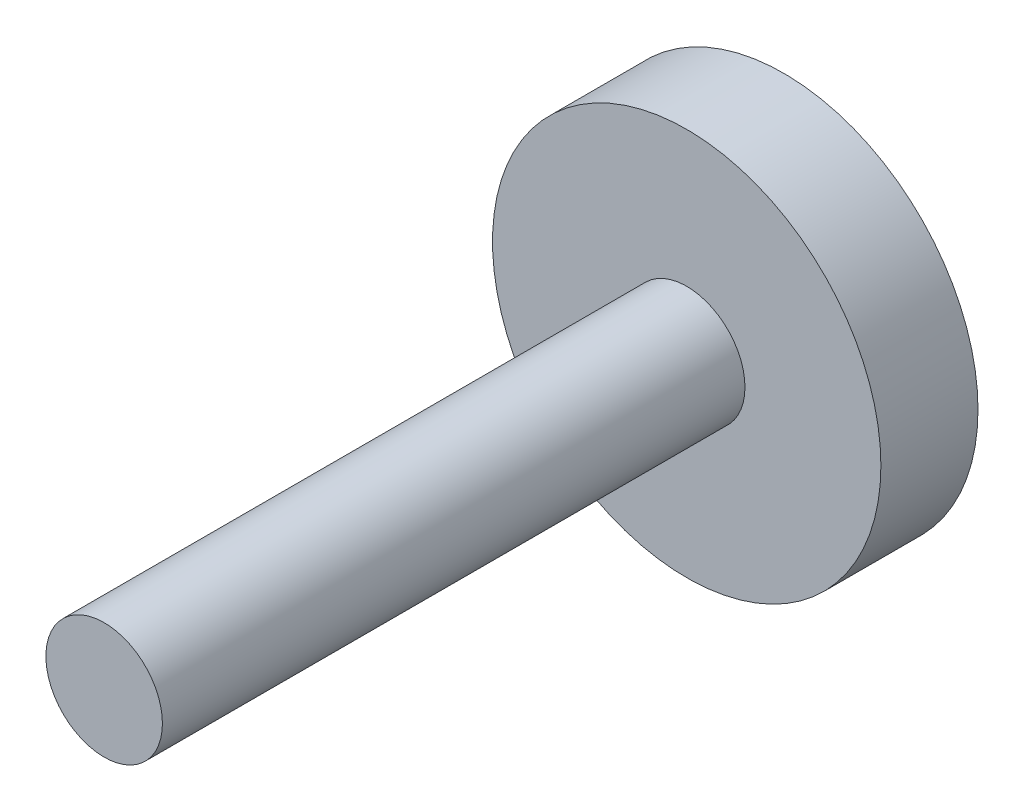
from build123d import *

# Parameters (mm, degrees)
SKETCH1_R           = 5
BOSS_EXTRUDE1_DEPTH = 1.25
SKETCH2_R           = 1.5
BOSS_EXTRUDE2_DEPTH = 15
BOSS_EXTRUDE3_DEPTH = 1


with BuildPart() as part:
    # Sketch1 → Boss-Extrude1 (new, symmetric)
    with BuildSketch(Plane.XY):
        Circle(SKETCH1_R)
    extrude(amount=BOSS_EXTRUDE1_DEPTH, both=True)

    # Sketch2 → Boss-Extrude2 (add)
    with BuildSketch(Plane.XY.offset(1.25)):
        Circle(SKETCH2_R)
    extrude(amount=BOSS_EXTRUDE2_DEPTH)

    # Sketch3 → Boss-Extrude3 (add)
    # profile 1 of 2: a face of its own
    with BuildSketch(Plane(origin=(0, 0, -1.25), x_dir=(-1, 0, 0), z_dir=(0, 0, -1))):
        Polygon((-1.479879797, 1.389092813), (-0.89930688, 1.389092813), (-0.89930688, -1.750907187), (-1.181101752, -1.750907187), (-1.181101752, 1.067041531), (-1.664178675, 1.067041531), align=None)
    # profile 2 of 2: a face of its own
    with BuildSketch(Plane(origin=(0, 0, -1.25), x_dir=(-1, 0, 0), z_dir=(0, 0, -1))):
        with BuildLine():
            Line((1.717359786, 1.469605634), (1.934366998, 1.299144896))
            Line((1.934366998, 1.299144896), (1.104707543, 0.030438967))
            add(Edge.make_bspline(
                [(1.104707543, 0.030438967), (1.159944877, 0.039243402), (1.267691543, 0.056417448), (1.37675352, 0.059250576), (1.429903857, 0.060631275)],
                knots=[0, 0, 0, 0, 1.025318673, 2, 2, 2, 2], degree=3))
            add(Edge.make_bspline(
                [(1.429903857, 0.060631275), (1.461817468, 0.059773506), (1.524638462, 0.058085014), (1.61687085, 0.04509093), (1.705498638, 0.024613544), (1.790154484, -0.005236423), (1.871142245, -0.043367106), (1.948926681, -0.08906655), (2.022045627, -0.144694503), (2.091440685, -0.206835063), (2.154444424, -0.275661158), (2.210225228, -0.348689786), (2.257080121, -0.425844862), (2.295095582, -0.507087307), (2.324615959, -0.592291889), (2.346136303, -0.681349591), (2.358857424, -0.774321825), (2.360584864, -0.837550817), (2.361462351, -0.869669206)],
                knots=[0, 0, 0, 0, 1.04369286, 2.054478336, 3.041073146, 4.015093852, 4.984733326, 5.965804835, 6.960378782, 7.985147595, 9.009457201, 10.008161701, 10.986880575, 11.956520048, 12.937015923, 13.931873656, 14.949455224, 16, 16, 16, 16], degree=3))
            add(Edge.make_bspline(
                [(2.361462351, -0.869669206), (2.360185622, -0.913610998), (2.357673323, -1.000078044), (2.332639632, -1.126016004), (2.293739836, -1.245993175), (2.238137139, -1.35809402), (2.169072944, -1.462164897), (2.084851332, -1.554378143), (1.988459174, -1.636619262), (1.879468161, -1.7053912), (1.762173045, -1.76155508), (1.638948681, -1.801895326), (1.510991756, -1.826731353), (1.424144193, -1.829844979), (1.380212351, -1.831420007)],
                knots=[0, 0, 0, 0, 1.031375318, 2.029502543, 3.004789286, 3.987476834, 4.960371455, 5.9300674, 6.912260825, 7.929083631, 8.949397511, 9.960523116, 10.96833055, 12, 12, 12, 12], degree=3))
            add(Edge.make_bspline(
                [(1.380212351, -1.831420007), (1.337959882, -1.830048989), (1.25426514, -1.82733324), (1.131147718, -1.803140942), (1.012847754, -1.763929427), (0.900194081, -1.709908617), (0.795837874, -1.64167383), (0.702476132, -1.559529386), (0.620574368, -1.46523118), (0.55241428, -1.35879384), (0.498353589, -1.244417135), (0.45781177, -1.125153515), (0.434130569, -1.001437531), (0.430821407, -0.917571595), (0.429154658, -0.875330264)],
                knots=[0, 0, 0, 0, 1.012016664, 2.004627821, 2.994792927, 3.992885782, 4.990978636, 5.973936114, 6.964471063, 7.975201453, 8.993600317, 9.990122807, 10.98767138, 12, 12, 12, 12], degree=3))
            add(Edge.make_bspline(
                [(0.429154658, -0.875330264), (0.430214583, -0.842993123), (0.432378747, -0.776966861), (0.447489675, -0.676967705), (0.471770662, -0.574647592), (0.498963283, -0.487845258), (0.52769483, -0.41673635), (0.551605966, -0.359405789), (0.58136778, -0.300408712), (0.613102756, -0.237722079), (0.64966749, -0.172961434), (0.689424958, -0.105044427), (0.733474359, -0.035051201), (0.764354162, 0.012447306), (0.780140235, 0.036729031)],
                knots=[0, 0, 0, 0, 1.173818275, 2.396712641, 3.66331629, 4.989737886, 5.693666774, 6.447286557, 7.243889047, 8.091586357, 8.998013824, 9.943181721, 10.948533338, 12, 12, 12, 12], degree=3))
            Line((0.780140235, 0.036729031), (1.717359786, 1.469605634))
        make_face()
        with BuildLine():
            add(Edge.make_bspline(
                [(1.370777254, -0.261420007), (1.346857412, -0.262118024), (1.300135011, -0.263481452), (1.231586645, -0.271398964), (1.166711328, -0.28630864), (1.104649556, -0.305297864), (1.046561617, -0.331407466), (0.992025344, -0.36312308), (0.94082984, -0.400463222), (0.893511339, -0.442898897), (0.85061027, -0.489360161), (0.813664912, -0.539124246), (0.781796245, -0.590991846), (0.755885127, -0.645396331), (0.735708317, -0.702316905), (0.721113372, -0.761491774), (0.712990863, -0.823317752), (0.711639558, -0.865243483), (0.71094953, -0.886652379)],
                knots=[0, 0, 0, 0, 1.129588631, 2.206414736, 3.251139165, 4.268635594, 5.265702196, 6.250456724, 7.242448911, 8.251968645, 9.246821453, 10.222880186, 11.173611482, 12.116736599, 13.062300278, 14.020270554, 14.989073742, 16, 16, 16, 16], degree=3))
            add(Edge.make_bspline(
                [(0.71094953, -0.886652379), (0.711511466, -0.90786979), (0.712613338, -0.949473973), (0.722618562, -1.01078398), (0.737901465, -1.069784498), (0.76063542, -1.126171361), (0.787753257, -1.180804057), (0.823554033, -1.231703714), (0.863222807, -1.281961719), (0.910640336, -1.327717325), (0.961529296, -1.370292696), (1.015897231, -1.40750641), (1.072560738, -1.439342577), (1.132284814, -1.464293104), (1.194222107, -1.48476975), (1.258888661, -1.499179191), (1.326329452, -1.507325721), (1.372013705, -1.508678786), (1.395308504, -1.509368725)],
                knots=[0, 0, 0, 0, 0.989467248, 1.94019797, 2.891935182, 3.827694429, 4.772920941, 5.730924762, 6.725747692, 7.756678648, 8.79901574, 9.819492441, 10.826891316, 11.826466727, 12.835195252, 13.867842842, 14.912794438, 16, 16, 16, 16], degree=3))
            add(Edge.make_bspline(
                [(1.395308504, -1.509368725), (1.418603266, -1.508678732), (1.464287444, -1.50732556), (1.531728777, -1.4991798), (1.596393326, -1.484767516), (1.658337908, -1.464301202), (1.718035077, -1.439312535), (1.774649027, -1.40770447), (1.828502803, -1.370063839), (1.879425169, -1.327790083), (1.926645331, -1.281701296), (1.967265518, -1.232152345), (2.001969905, -1.180392679), (2.030170861, -1.126386572), (2.05265442, -1.069750403), (2.068014822, -1.010793114), (2.077999384, -0.949471582), (2.079104095, -0.907868982), (2.079667479, -0.886652379)],
                knots=[0, 0, 0, 0, 1.087397944, 2.132534446, 3.165364764, 4.174271784, 5.174024072, 6.181601208, 7.194203697, 8.236725232, 9.267838612, 10.269026844, 11.221737037, 12.171628256, 13.107553087, 14.05945871, 15.010357665, 16, 16, 16, 16], degree=3))
            add(Edge.make_bspline(
                [(2.079667479, -0.886652379), (2.079173787, -0.865215554), (2.078204832, -0.823142036), (2.067245381, -0.76151943), (2.052045651, -0.702016245), (2.029094018, -0.645006451), (1.999276089, -0.590715019), (1.96295669, -0.538867697), (1.920941184, -0.489066986), (1.872407962, -0.44280778), (1.81957501, -0.400510116), (1.763399884, -0.363171428), (1.704629874, -0.331659306), (1.643324565, -0.305366649), (1.578781522, -0.286392549), (1.512042761, -0.271452211), (1.442254697, -0.263501715), (1.39490654, -0.262122748), (1.370777254, -0.261420007)],
                knots=[0, 0, 0, 0, 0.978206639, 1.919901502, 2.851605144, 3.780102724, 4.718870031, 5.675451981, 6.667674623, 7.690630536, 8.733308323, 9.756129687, 10.767539656, 11.776269907, 12.797430371, 13.836405707, 14.897401972, 16, 16, 16, 16], degree=3))
        make_face(mode=Mode.SUBTRACT)
    extrude(amount=BOSS_EXTRUDE3_DEPTH)


solid = part.part
